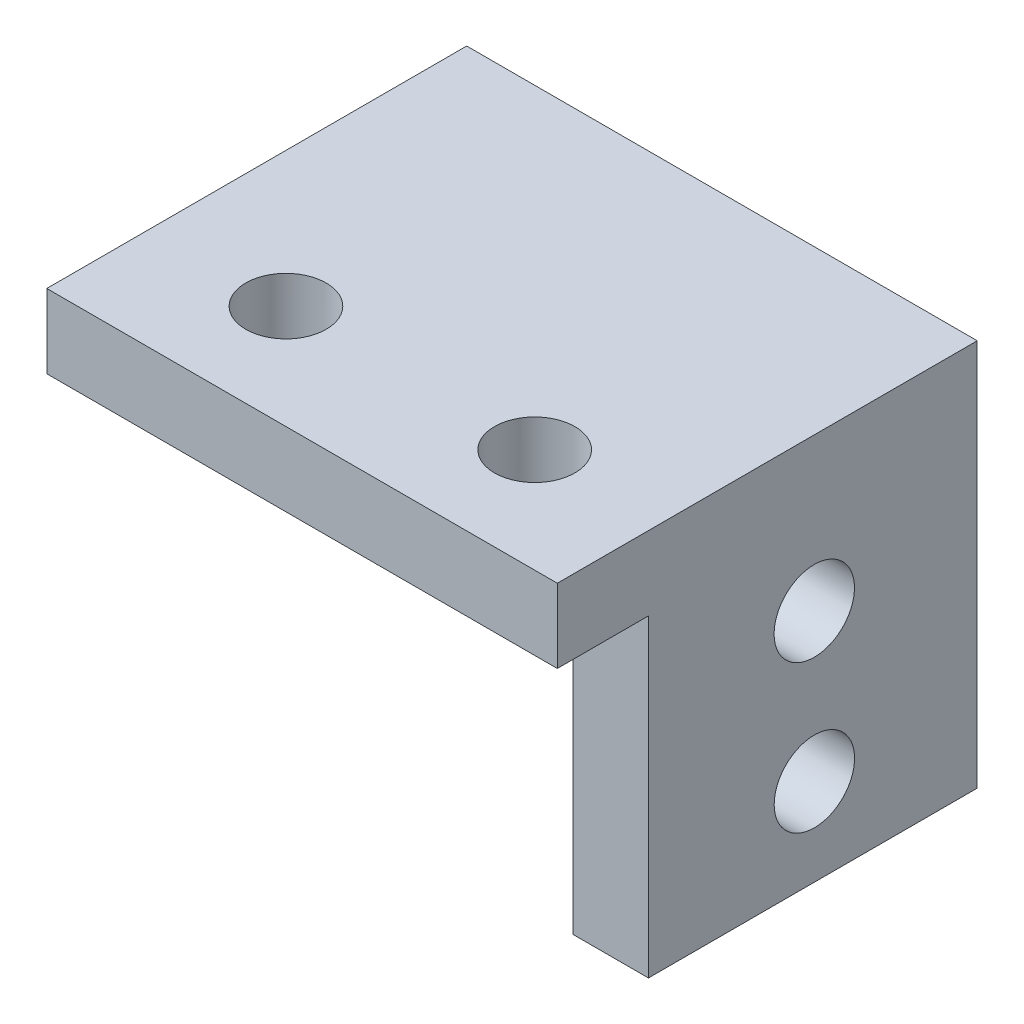
from build123d import *

# Parameters (mm, degrees)
SKETCH1_W           = 20.32
SKETCH1_H           = 20.32
BOSS_EXTRUDE1_DEPTH = 3
SKETCH2_W           = 13.085786438
SKETCH2_H           = 15.522266203
BOSS_EXTRUDE2_DEPTH = 3
SKETCH5_W           = 31.587668609
SKETCH5_H           = 25.562972936
CUT_EXTRUDE1_DEPTH  = 0.1
SKETCH6_W           = 20.32
SKETCH6_H           = 3.606
CUT_EXTRUDE2_DEPTH  = 10
SKETCH7_R           = 1.6
CUT_EXTRUDE3_DEPTH  = 10
SKETCH8_R           = 1.6
CUT_EXTRUDE4_DEPTH  = 10


with BuildPart() as part:
    # Sketch1 → Boss-Extrude1 (new body)
    with BuildSketch(Plane(origin=(0, 0, 0), x_dir=(1, 0, 0), z_dir=(0, 1, 0))):
        with Locations((10.16, 10.16)):
            Rectangle(SKETCH1_W, SKETCH1_H)
    extrude(amount=BOSS_EXTRUDE1_DEPTH)

    # Sketch2 → Boss-Extrude2 (add)
    with BuildSketch(Plane(origin=(20.32, 0, 0), x_dir=(0, 0, -1), z_dir=(1, 0, 0))):
        with Locations((10.171106781, -4.720966496)):
            Rectangle(SKETCH2_W, SKETCH2_H)
    extrude(amount=-BOSS_EXTRUDE2_DEPTH)

    # Sketch5 → Cut-Extrude1 (cut)
    with BuildSketch(Plane(origin=(0, 3.040166606, 0), x_dir=(1, 0, 0), z_dir=(0, 1, 0))):
        with Locations((13.28189867, 9.26803237)):
            Rectangle(SKETCH5_W, SKETCH5_H)
    extrude(amount=-CUT_EXTRUDE1_DEPTH, mode=Mode.SUBTRACT)

    # Sketch6 → Cut-Extrude2 (cut)
    with BuildSketch(Plane(origin=(0, 0, 0), x_dir=(-1, 0, 0), z_dir=(0, -1, 0))):
        with Locations((-10.16, 18.517)):
            Rectangle(SKETCH6_W, SKETCH6_H)
    extrude(amount=-CUT_EXTRUDE2_DEPTH, mode=Mode.SUBTRACT)

    # Sketch7 → Cut-Extrude3 (cut)
    with BuildSketch(Plane(origin=(0, 2.940166606, 0), x_dir=(1, 0, 0), z_dir=(0, 1, 0))):
        with Locations(Location((5.37, 4.15, 0), (0, 0, 270))):
            Circle(SKETCH7_R)
        with Locations(Location((15.27, 4.15, 0), (0, 0, 270))):
            Circle(SKETCH7_R)
    extrude(amount=-CUT_EXTRUDE3_DEPTH, mode=Mode.SUBTRACT)

    # Sketch8 → Cut-Extrude4 (cut)
    with BuildSketch(Plane.ZY.offset(-17.32)):
        with Locations((-10.232213562, -9.006524303)):
            Circle(SKETCH8_R)
        with Locations((-10.228213562, -3.127074003)):
            Circle(SKETCH8_R)
    extrude(amount=-CUT_EXTRUDE4_DEPTH, mode=Mode.SUBTRACT)


solid = part.part
